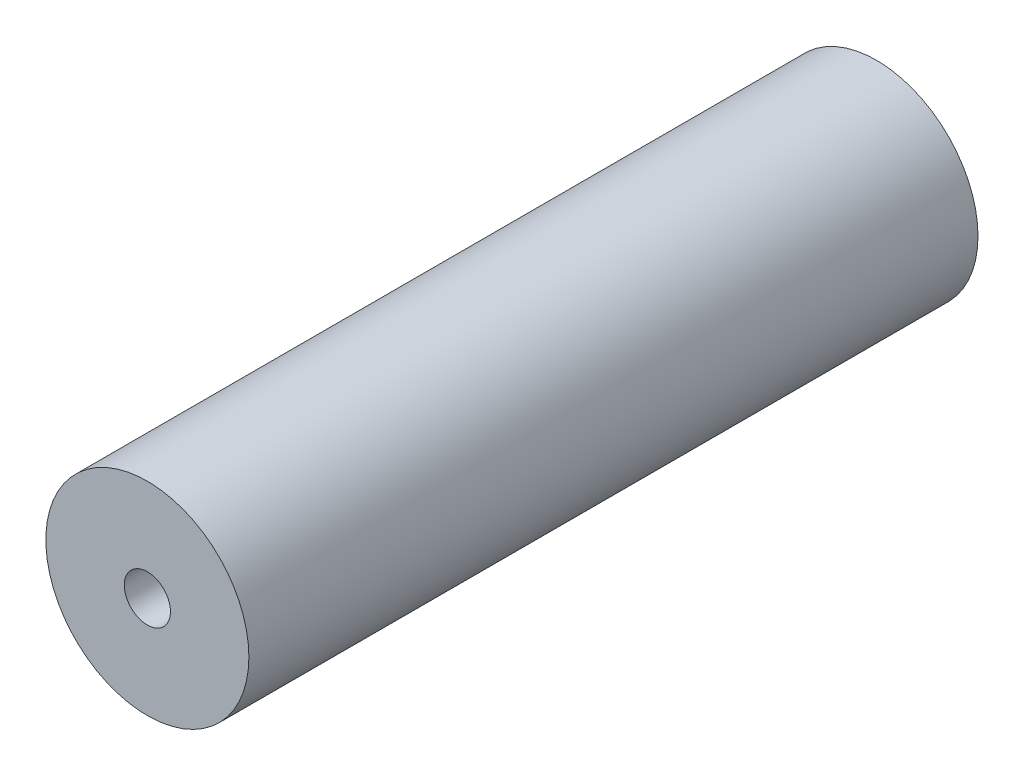
from build123d import *

# Parameters (mm, degrees)
SKETCH1_R           = 5.5
SKETCH1_R_2         = 1.25
BOSS_EXTRUDE1_DEPTH = 39.5


with BuildPart() as part:
    # Sketch1 → Boss-Extrude1 (new body)
    with BuildSketch(Plane.XY):
        Circle(SKETCH1_R)
        Circle(SKETCH1_R_2, mode=Mode.SUBTRACT)
    extrude(amount=BOSS_EXTRUDE1_DEPTH)


solid = part.part
